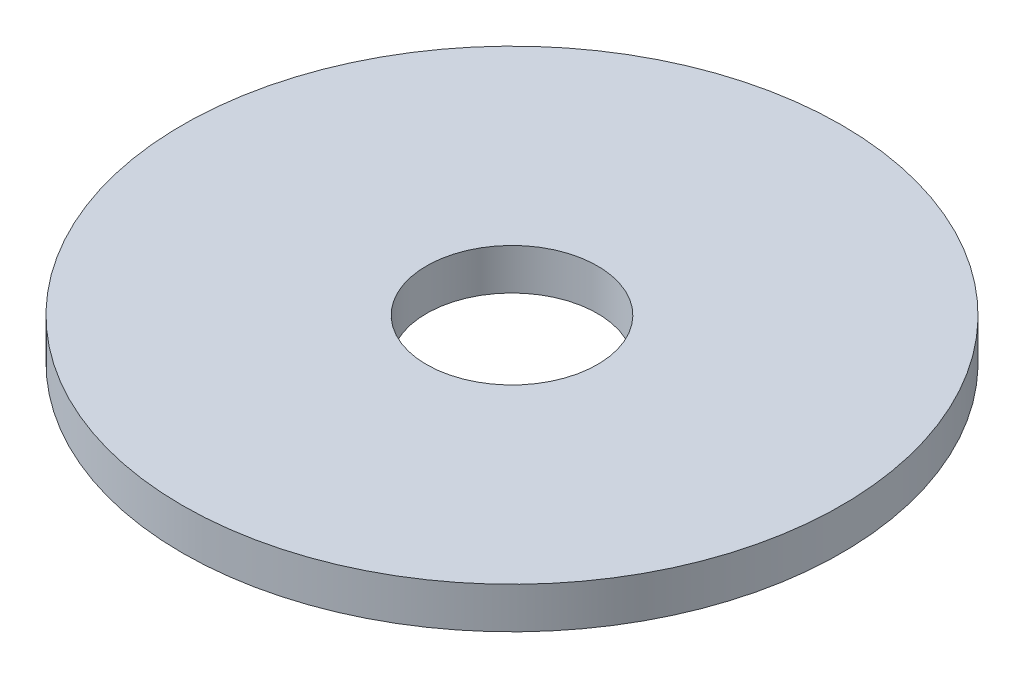
from build123d import *

# Parameters (mm, degrees)
SKETCH2_R           = 16
SKETCH2_R_2         = 4.15
BOSS_EXTRUDE1_DEPTH = 2


with BuildPart() as part:
    # Sketch2 → Boss-Extrude1 (new body)
    with BuildSketch(Plane(origin=(0, 0, 0), x_dir=(1, 0, 0), z_dir=(0, 1, 0))):
        with Locations(Location((0, 0, 0), (0, 0, 270))):
            Circle(SKETCH2_R)
        with Locations(Location((0, 0, 0), (0, 0, 270))):
            Circle(SKETCH2_R_2, mode=Mode.SUBTRACT)
    extrude(amount=BOSS_EXTRUDE1_DEPTH)


solid = part.part
